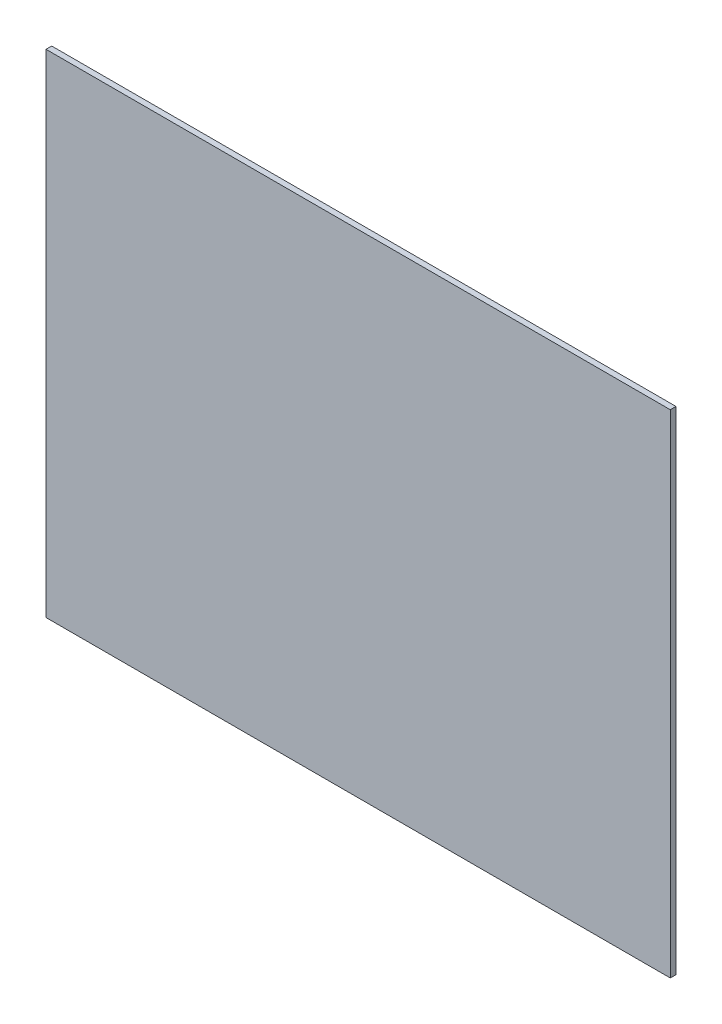
from build123d import *

# Parameters (mm, degrees)
SKETCH2_W           = 548
SKETCH2_H           = 432
BOSS_EXTRUDE1_DEPTH = 5


with BuildPart() as part:
    # Sketch2 → Boss-Extrude1 (new body)
    with BuildSketch(Plane.XY):
        with Locations((-65.299065421, 29.191588785)):
            Rectangle(SKETCH2_W, SKETCH2_H)
    extrude(amount=BOSS_EXTRUDE1_DEPTH)


solid = part.part
